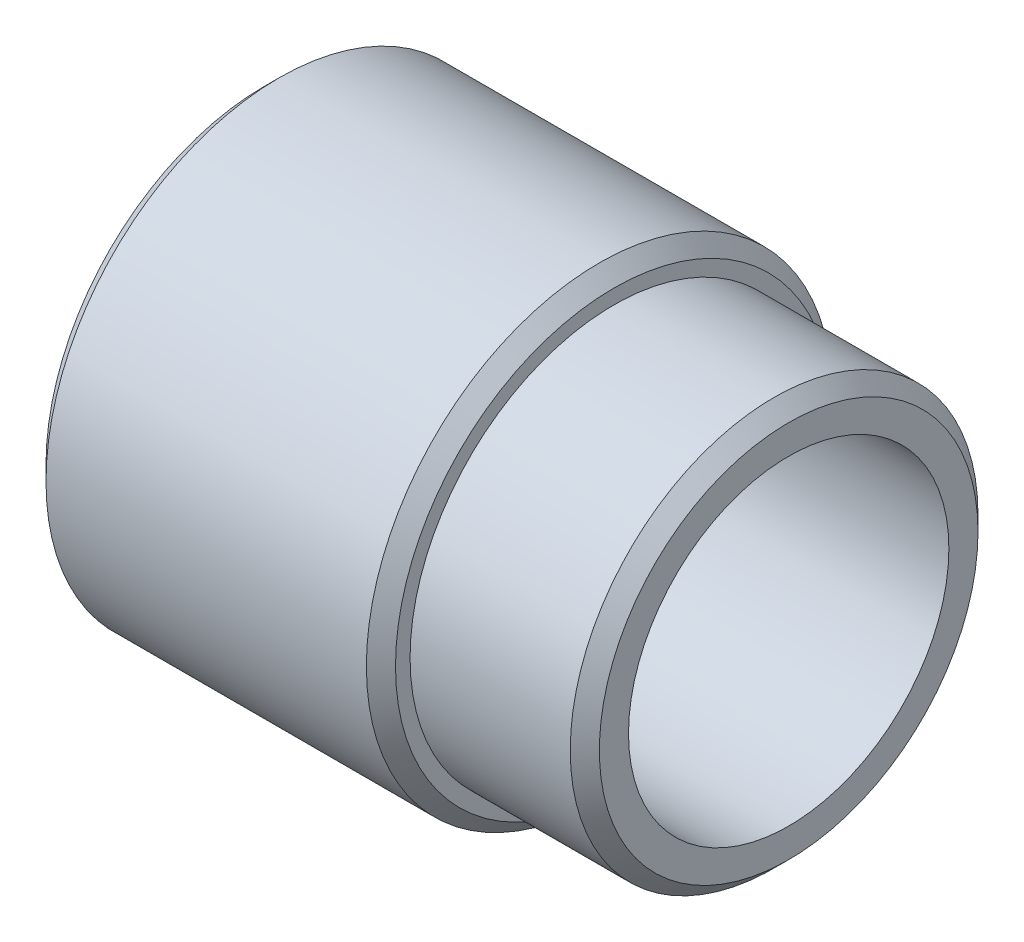
from build123d import *

# Parameters (mm, degrees)
CUT_EXTRUDE_START   = -2
SKETCH_4_R          = 9
CUT_EXTRUDE_1_DEPTH = 2
EXTRUDE_START       = -12
SKETCH_5_R          = 8
SKETCH_5_R_2        = 5.5
EXTRUDE_1_DEPTH     = 12
CHAMFER_1_SIZE      = 0.5


with BuildPart() as part:
    # Эскиз1 → Повернуть1 (revolve)
    with BuildSketch(Plane.XY, mode=Mode.PRIVATE) as revolve_1_sk:
        Polygon((0, 5.5), (20, 5.5), (20, 9), (18, 9), (18, 7), (0, 7), align=None)
    revolve(revolve_1_sk.sketch.rotate(Axis((0, 0, 0), (1, 0, 0)), 90), axis=Axis((0, 0, 0), (1, 0, 0)))

    # Эскиз4 → Вырез-Вытянуть1 (cut)
    with BuildSketch(Plane(origin=(20, 0, 0), x_dir=(0, 0, -1), z_dir=(1, 0, 0)).offset(CUT_EXTRUDE_START)):
        Circle(SKETCH_4_R)
    extrude(amount=CUT_EXTRUDE_1_DEPTH, mode=Mode.SUBTRACT)

    # Эскиз5 → Бобышка-Вытянуть1 (add)
    with BuildSketch(Plane.ZY.offset(EXTRUDE_START)):
        Circle(SKETCH_5_R)
        Circle(SKETCH_5_R_2, mode=Mode.SUBTRACT)
    extrude(amount=EXTRUDE_1_DEPTH)

    # Фаска1
    chamfer_1_edges = [part.edges().sort_by_distance(p)[0] for p in [
        (18, 0, -7),
        (12, 0, -8),
        (0, 0, -8),
    ]]
    chamfer(chamfer_1_edges, length=CHAMFER_1_SIZE)


solid = part.part
